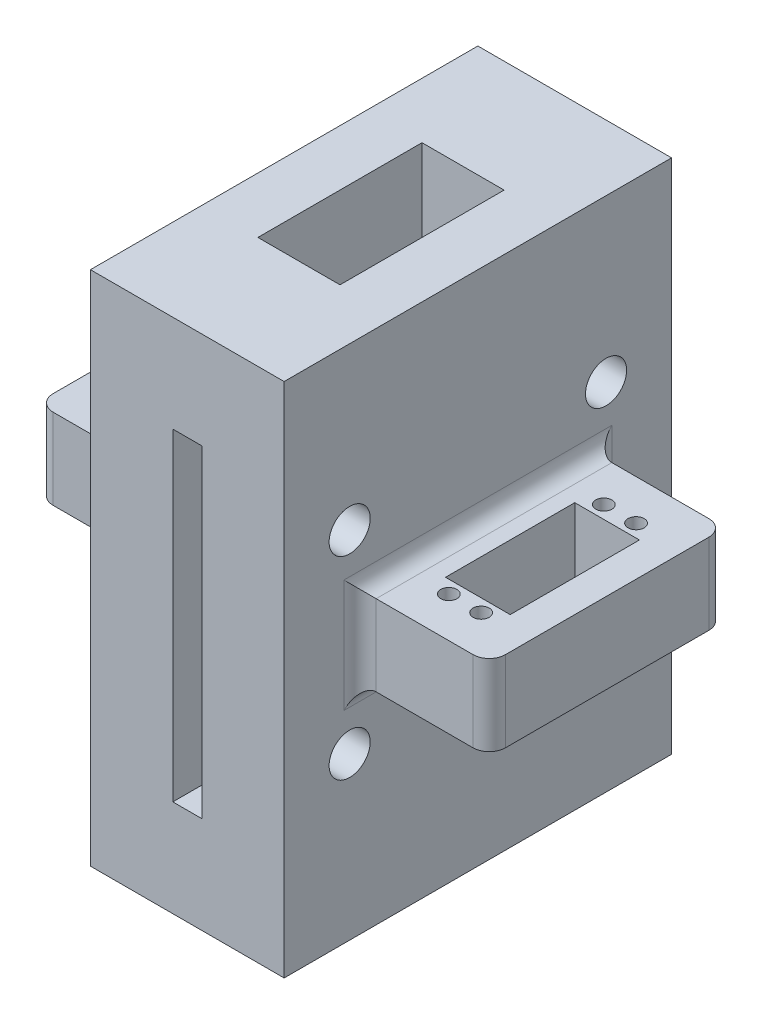
from build123d import *

# Parameters (mm, degrees)
SKETCH1_W                      = 60
SKETCH1_H                      = 120
BOSS_EXTRUDE1_DEPTH            = 80
CUT_EXTRUDE2_REACH             = 106.403
SKETCH3_W                      = 50.83
SKETCH3_H                      = 25.43
CUT_EXTRUDE2_DIRECTION_2_REACH = 106.403
CUT_EXTRUDE3_REACH             = 106.403
SKETCH5_W                      = 8.9675
SKETCH5_H                      = 100
CUT_EXTRUDE3_DIRECTION_2_REACH = 106.403
CUT_EXTRUDE4_REACH             = 106.403
SKETCH6_R                      = 6.365
CUT_EXTRUDE4_DIRECTION_2_REACH = 106.403
SKETCH7_W                      = 40.03
SKETCH7_H                      = 73
SKETCH7_R                      = 2.5
SKETCH7_W_2                    = 20.03
SKETCH7_H_2                    = 40.03
BOSS_EXTRUDE2_DEPTH            = 12.5
FILLET2_R                      = 5


with BuildPart() as part:
    # Sketch1 → Boss-Extrude1 (new, symmetric)
    with BuildSketch(Plane(origin=(0, 0, 0), x_dir=(1, 0, 0), z_dir=(0, 1, 0))):
        Rectangle(SKETCH1_W, SKETCH1_H)
    extrude(amount=BOSS_EXTRUDE1_DEPTH, both=True)

    # Cut-Extrude2: up to this face of the body (flat: up to its plane)
    cut_extrude2_end = Plane(part.part.faces().sort_by_distance((0, -80, 0))[0])
    # Sketch3 → Cut-Extrude2 (cut, up to the picked face)
    with BuildSketch(Plane(origin=(0, 0, 0), x_dir=(0, 0, -1), z_dir=(0, 1, 0)), mode=Mode.PRIVATE) as cut_extrude2_sk1:
        Rectangle(SKETCH3_W, SKETCH3_H)
    cut_extrude2_tool1 = split(extrude(cut_extrude2_sk1.sketch, amount=-CUT_EXTRUDE2_REACH, mode=Mode.PRIVATE), bisect_by=cut_extrude2_end, keep=Keep.BOTH, mode=Mode.PRIVATE)
    add(cut_extrude2_tool1.solids().sort_by(Axis((0, 0, 0), (0, -1, 0)))[0], mode=Mode.SUBTRACT)

    # Cut-Extrude2 direction 2: up to this face of the body (flat: up to its plane)
    cut_extrude2_direction_2_end = Plane(part.part.faces().sort_by_distance((0, 80, 0))[0])
    # Sketch3 → Cut-Extrude2 direction 2 (cut, up to the picked face)
    with BuildSketch(Plane(origin=(0, 0, 0), x_dir=(0, 0, -1), z_dir=(0, 1, 0)), mode=Mode.PRIVATE) as cut_extrude2_direction_2_sk1:
        Rectangle(SKETCH3_W, SKETCH3_H)
    cut_extrude2_direction_2_tool1 = split(extrude(cut_extrude2_direction_2_sk1.sketch, amount=CUT_EXTRUDE2_DIRECTION_2_REACH, mode=Mode.PRIVATE), bisect_by=cut_extrude2_direction_2_end, keep=Keep.BOTH, mode=Mode.PRIVATE)
    add(cut_extrude2_direction_2_tool1.solids().sort_by(Axis((0, 0, 0), (0, 1, 0)))[0], mode=Mode.SUBTRACT)

    # Cut-Extrude3: up to this face of the body (flat: up to its plane)
    cut_extrude3_end = Plane(part.part.faces().sort_by_distance((0, 0, 60))[0])
    # Sketch5 → Cut-Extrude3 (cut, up to the picked face)
    with BuildSketch(Plane.XY, mode=Mode.PRIVATE) as cut_extrude3_sk1:
        Rectangle(SKETCH5_W, SKETCH5_H)
    cut_extrude3_tool1 = split(extrude(cut_extrude3_sk1.sketch, amount=CUT_EXTRUDE3_REACH, mode=Mode.PRIVATE), bisect_by=cut_extrude3_end, keep=Keep.BOTH, mode=Mode.PRIVATE)
    add(cut_extrude3_tool1.solids().sort_by(Axis((0, 0, 0), (0, 0, 1)))[0], mode=Mode.SUBTRACT)

    # Cut-Extrude3 direction 2: up to this face of the body (flat: up to its plane)
    cut_extrude3_direction_2_end = Plane(part.part.faces().sort_by_distance((0, 0, -60))[0])
    # Sketch5 → Cut-Extrude3 direction 2 (cut, up to the picked face)
    with BuildSketch(Plane.XY, mode=Mode.PRIVATE) as cut_extrude3_direction_2_sk1:
        Rectangle(SKETCH5_W, SKETCH5_H)
    cut_extrude3_direction_2_tool1 = split(extrude(cut_extrude3_direction_2_sk1.sketch, amount=-CUT_EXTRUDE3_DIRECTION_2_REACH, mode=Mode.PRIVATE), bisect_by=cut_extrude3_direction_2_end, keep=Keep.BOTH, mode=Mode.PRIVATE)
    add(cut_extrude3_direction_2_tool1.solids().sort_by(Axis((0, 0, 0), (0, 0, -1)))[0], mode=Mode.SUBTRACT)

    # Cut-Extrude4: up to this face of the body (flat: up to its plane)
    cut_extrude4_end = Plane(part.part.faces().sort_by_distance((30, 0, 0))[0])
    # Sketch6 → Cut-Extrude4 (cut, up to the picked face)
    with BuildSketch(Plane(origin=(0, 0, 0), x_dir=(0, 0, -1), z_dir=(1, 0, 0)), mode=Mode.PRIVATE) as cut_extrude4_sk1:
        with Locations((-39.705, -30)):
            Circle(SKETCH6_R)
    cut_extrude4_tool1 = split(extrude(cut_extrude4_sk1.sketch, amount=CUT_EXTRUDE4_REACH, mode=Mode.PRIVATE), bisect_by=cut_extrude4_end, keep=Keep.BOTH, mode=Mode.PRIVATE)
    # Sketch6 → Cut-Extrude4 (cut, up to the picked face)
    with BuildSketch(Plane(origin=(0, 0, 0), x_dir=(0, 0, -1), z_dir=(1, 0, 0)), mode=Mode.PRIVATE) as cut_extrude4_sk2:
        with Locations((-39.705, 30)):
            Circle(SKETCH6_R)
    cut_extrude4_tool2 = split(extrude(cut_extrude4_sk2.sketch, amount=CUT_EXTRUDE4_REACH, mode=Mode.PRIVATE), bisect_by=cut_extrude4_end, keep=Keep.BOTH, mode=Mode.PRIVATE)
    # Sketch6 → Cut-Extrude4 (cut, up to the picked face)
    with BuildSketch(Plane(origin=(0, 0, 0), x_dir=(0, 0, -1), z_dir=(1, 0, 0)), mode=Mode.PRIVATE) as cut_extrude4_sk3:
        with Locations(Location((39.705, -30, 0), (0, 0, 180))):
            Circle(SKETCH6_R)
    cut_extrude4_tool3 = split(extrude(cut_extrude4_sk3.sketch, amount=CUT_EXTRUDE4_REACH, mode=Mode.PRIVATE), bisect_by=cut_extrude4_end, keep=Keep.BOTH, mode=Mode.PRIVATE)
    # Sketch6 → Cut-Extrude4 (cut, up to the picked face)
    with BuildSketch(Plane(origin=(0, 0, 0), x_dir=(0, 0, -1), z_dir=(1, 0, 0)), mode=Mode.PRIVATE) as cut_extrude4_sk4:
        with Locations(Location((39.705, 30, 0), (0, 0, 180))):
            Circle(SKETCH6_R)
    cut_extrude4_tool4 = split(extrude(cut_extrude4_sk4.sketch, amount=CUT_EXTRUDE4_REACH, mode=Mode.PRIVATE), bisect_by=cut_extrude4_end, keep=Keep.BOTH, mode=Mode.PRIVATE)
    add(cut_extrude4_tool1.solids().sort_by(Axis((0, -30, 39.705), (1, 0, 0)))[0], mode=Mode.SUBTRACT)
    add(cut_extrude4_tool2.solids().sort_by(Axis((0, 30, 39.705), (1, 0, 0)))[0], mode=Mode.SUBTRACT)
    add(cut_extrude4_tool3.solids().sort_by(Axis((0, -30, -39.705), (1, 0, 0)))[0], mode=Mode.SUBTRACT)
    add(cut_extrude4_tool4.solids().sort_by(Axis((0, 30, -39.705), (1, 0, 0)))[0], mode=Mode.SUBTRACT)

    # Cut-Extrude4 direction 2: up to this face of the body (flat: up to its plane)
    cut_extrude4_direction_2_end = Plane(part.part.faces().sort_by_distance((-30, 0, 0))[0])
    # Sketch6 → Cut-Extrude4 direction 2 (cut, up to the picked face)
    with BuildSketch(Plane(origin=(0, 0, 0), x_dir=(0, 0, -1), z_dir=(1, 0, 0)), mode=Mode.PRIVATE) as cut_extrude4_direction_2_sk1:
        with Locations((-39.705, -30)):
            Circle(SKETCH6_R)
    cut_extrude4_direction_2_tool1 = split(extrude(cut_extrude4_direction_2_sk1.sketch, amount=-CUT_EXTRUDE4_DIRECTION_2_REACH, mode=Mode.PRIVATE), bisect_by=cut_extrude4_direction_2_end, keep=Keep.BOTH, mode=Mode.PRIVATE)
    # Sketch6 → Cut-Extrude4 direction 2 (cut, up to the picked face)
    with BuildSketch(Plane(origin=(0, 0, 0), x_dir=(0, 0, -1), z_dir=(1, 0, 0)), mode=Mode.PRIVATE) as cut_extrude4_direction_2_sk2:
        with Locations((-39.705, 30)):
            Circle(SKETCH6_R)
    cut_extrude4_direction_2_tool2 = split(extrude(cut_extrude4_direction_2_sk2.sketch, amount=-CUT_EXTRUDE4_DIRECTION_2_REACH, mode=Mode.PRIVATE), bisect_by=cut_extrude4_direction_2_end, keep=Keep.BOTH, mode=Mode.PRIVATE)
    # Sketch6 → Cut-Extrude4 direction 2 (cut, up to the picked face)
    with BuildSketch(Plane(origin=(0, 0, 0), x_dir=(0, 0, -1), z_dir=(1, 0, 0)), mode=Mode.PRIVATE) as cut_extrude4_direction_2_sk3:
        with Locations(Location((39.705, -30, 0), (0, 0, 180))):
            Circle(SKETCH6_R)
    cut_extrude4_direction_2_tool3 = split(extrude(cut_extrude4_direction_2_sk3.sketch, amount=-CUT_EXTRUDE4_DIRECTION_2_REACH, mode=Mode.PRIVATE), bisect_by=cut_extrude4_direction_2_end, keep=Keep.BOTH, mode=Mode.PRIVATE)
    # Sketch6 → Cut-Extrude4 direction 2 (cut, up to the picked face)
    with BuildSketch(Plane(origin=(0, 0, 0), x_dir=(0, 0, -1), z_dir=(1, 0, 0)), mode=Mode.PRIVATE) as cut_extrude4_direction_2_sk4:
        with Locations(Location((39.705, 30, 0), (0, 0, 180))):
            Circle(SKETCH6_R)
    cut_extrude4_direction_2_tool4 = split(extrude(cut_extrude4_direction_2_sk4.sketch, amount=-CUT_EXTRUDE4_DIRECTION_2_REACH, mode=Mode.PRIVATE), bisect_by=cut_extrude4_direction_2_end, keep=Keep.BOTH, mode=Mode.PRIVATE)
    add(cut_extrude4_direction_2_tool1.solids().sort_by(Axis((0, -30, 39.705), (-1, 0, 0)))[0], mode=Mode.SUBTRACT)
    add(cut_extrude4_direction_2_tool2.solids().sort_by(Axis((0, 30, 39.705), (-1, 0, 0)))[0], mode=Mode.SUBTRACT)
    add(cut_extrude4_direction_2_tool3.solids().sort_by(Axis((0, -30, -39.705), (-1, 0, 0)))[0], mode=Mode.SUBTRACT)
    add(cut_extrude4_direction_2_tool4.solids().sort_by(Axis((0, 30, -39.705), (-1, 0, 0)))[0], mode=Mode.SUBTRACT)

    # Sketch7 → Boss-Extrude2 (add, symmetric)
    with BuildSketch(Plane(origin=(0, 0, 0), x_dir=(1, 0, 0), z_dir=(0, 1, 0))):
        with Locations((-50.015, 0)):
            Rectangle(SKETCH7_W, SKETCH7_H)
        with Locations(Location((-55.015, 24, 0), (0, 0, 270))):
            Circle(SKETCH7_R, mode=Mode.SUBTRACT)
        with Locations(Location((-45.015, 24, 0), (0, 0, 270))):
            Circle(SKETCH7_R, mode=Mode.SUBTRACT)
        with Locations(Location((-55.015, -24, 0), (0, 0, 270))):
            Circle(SKETCH7_R, mode=Mode.SUBTRACT)
        with Locations(Location((-45.015, -24, 0), (0, 0, 270))):
            Circle(SKETCH7_R, mode=Mode.SUBTRACT)
        with Locations((-50.015, 0)):
            Rectangle(SKETCH7_W_2, SKETCH7_H_2, mode=Mode.SUBTRACT)
    boss_extrude2 = extrude(amount=BOSS_EXTRUDE2_DEPTH, both=True)

    # Mirror2: Boss-Extrude2 across plane
    add(boss_extrude2.mirror(Plane(origin=(0, 0, 0), x_dir=(0, 0, 1), z_dir=(1, 0, 0))))

    # Fillet2
    fillet2_edges = [part.edges().sort_by_distance(p)[0] for p in [
        (-30, 12.5, 0),
        (-30, -12.5, 0),
        (-30, 0, 36.5),
        (-30, 0, -36.5),
        (-70.03, 0, -36.5),
        (-70.03, 0, 36.5),
        (30, 12.5, 0),
        (30, 0, -36.5),
        (30, 0, 36.5),
        (70.03, 0, 36.5),
        (70.03, 0, -36.5),
        (30, -12.5, 0),
    ]]
    fillet(fillet2_edges, radius=FILLET2_R)


solid = part.part
